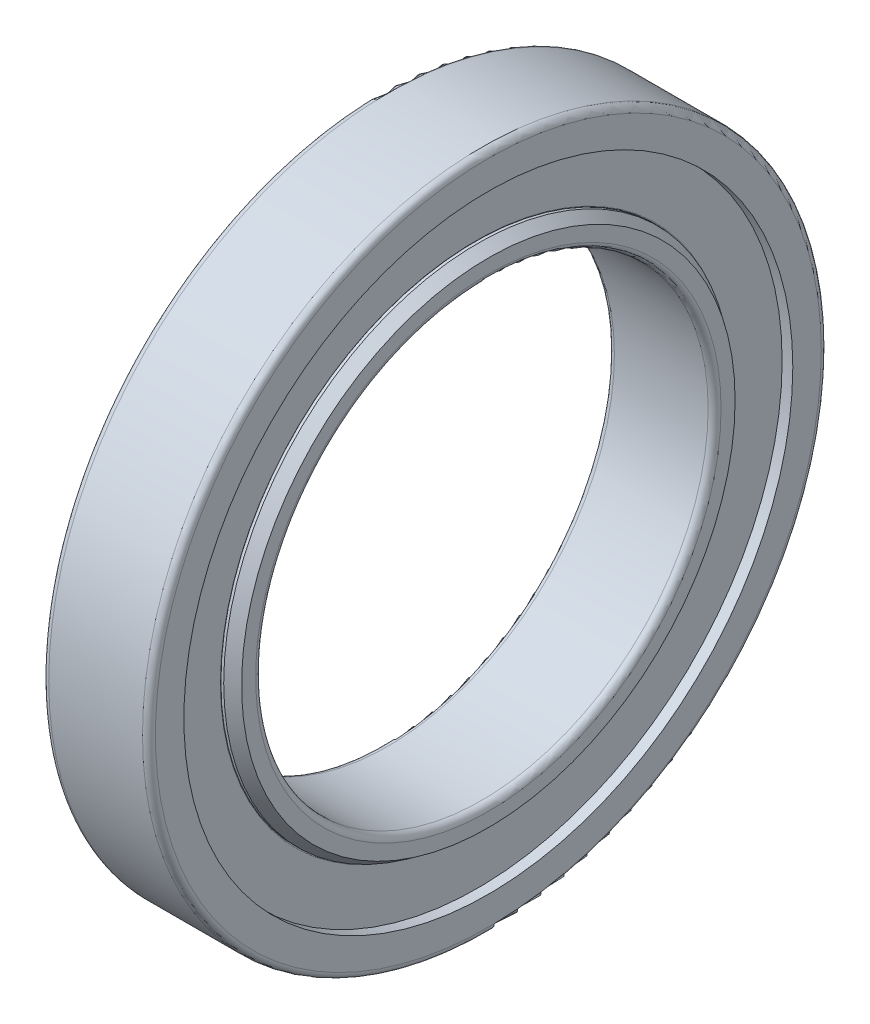
from build123d import *


with BuildPart() as part:
    # OutRacSke → OuterRace (revolve)
    with BuildSketch(Plane.XY):
        with BuildLine():
            Line((-13.2, 94.19375), (-16.5, 94.19375))
            Line((-16.5, 94.19375), (-16.5, 103))
            ThreePointArc((-16.5, 103), (-15.914213562, 104.414213562), (-14.5, 105))
            Line((-14.5, 105), (14.5, 105))
            ThreePointArc((14.5, 105), (15.914213562, 104.414213562), (16.5, 103))
            Line((16.5, 103), (16.5, 94.19375))
            Line((16.5, 94.19375), (13.2, 94.19375))
            Line((13.2, 94.19375), (13.2, 96.425))
            Line((13.2, 96.425), (-13.2, 96.425))
            Line((-13.2, 96.425), (-13.2, 94.19375))
        make_face()
    revolve(axis=Axis((-90, 0, 0), (1, 0, 0)))

    # RolSimSke → RollersSimplified (revolve)
    with BuildSketch(Plane(origin=(0, 101.6, 0), x_dir=(1, 0, 0), z_dir=(0, 0, 1))):
        with BuildLine():
            Line((-12.54, -5.5272), (-12.54, -22.6728))
            ThreePointArc((-12.54, -22.6728), (-12.435378542, -22.925378542), (-12.1828, -23.03))
            Line((-12.1828, -23.03), (12.1828, -23.03))
            ThreePointArc((12.1828, -23.03), (12.435378542, -22.925378542), (12.54, -22.6728))
            Line((12.54, -22.6728), (12.54, -5.5272))
            ThreePointArc((12.54, -5.5272), (12.435378542, -5.274621458), (12.1828, -5.17))
            Line((12.1828, -5.17), (-12.1828, -5.17))
            ThreePointArc((-12.1828, -5.17), (-12.435378542, -5.274621458), (-12.54, -5.5272))
        make_face()
    revolve(axis=Axis((25.4, 0, 0), (-1, 0, 0)))

    # InsRacSke → InnerRace (revolve)
    with BuildSketch(Plane.XY):
        with BuildLine():
            Line((-13.2, 78.575), (-16.5, 76.34375))
            Line((-16.5, 76.34375), (-16.5, 72))
            ThreePointArc((-16.5, 72), (-15.914213562, 70.585786438), (-14.5, 70))
            Line((-14.5, 70), (14.5, 70))
            ThreePointArc((14.5, 70), (15.914213562, 70.585786438), (16.5, 72))
            Line((16.5, 72), (16.5, 76.34375))
            Line((16.5, 76.34375), (13.2, 78.575))
            Line((13.2, 78.575), (-13.2, 78.575))
        make_face()
    revolve(axis=Axis((-90, 0, 0), (1, 0, 0)))


solid = part.part
